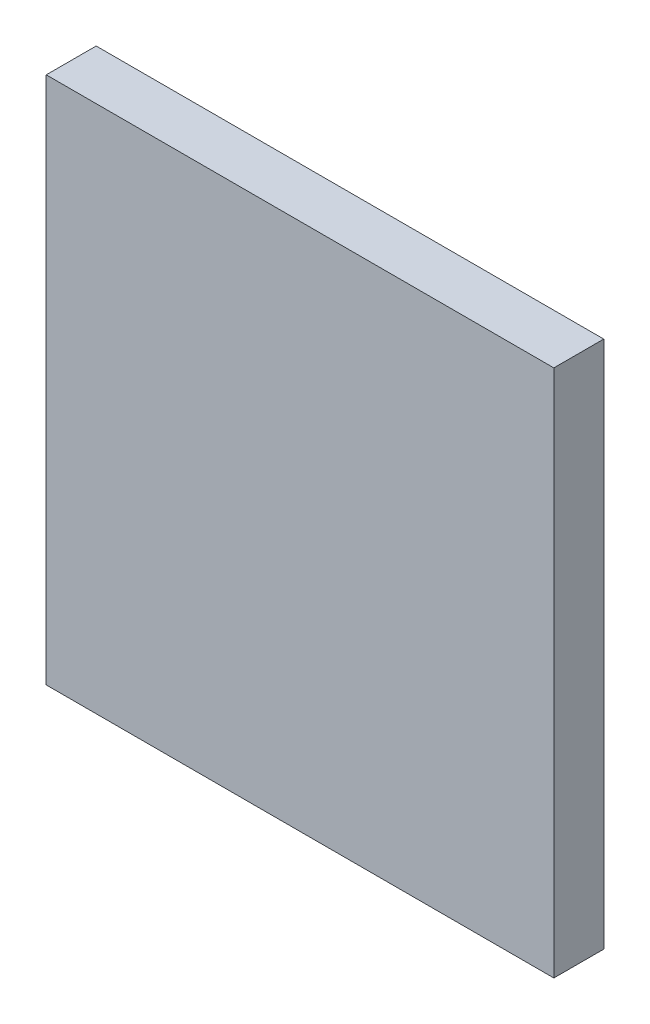
from build123d import *

# Parameters (mm, degrees)
SKETCH_1_W      = 244
SKETCH_1_H      = 254
EXTRUDE_1_DEPTH = 24


with BuildPart() as part:
    # 草图1 → 凸台-拉伸1 (new body)
    with BuildSketch(Plane.XY):
        Rectangle(SKETCH_1_W, SKETCH_1_H)
    extrude(amount=EXTRUDE_1_DEPTH)


solid = part.part
